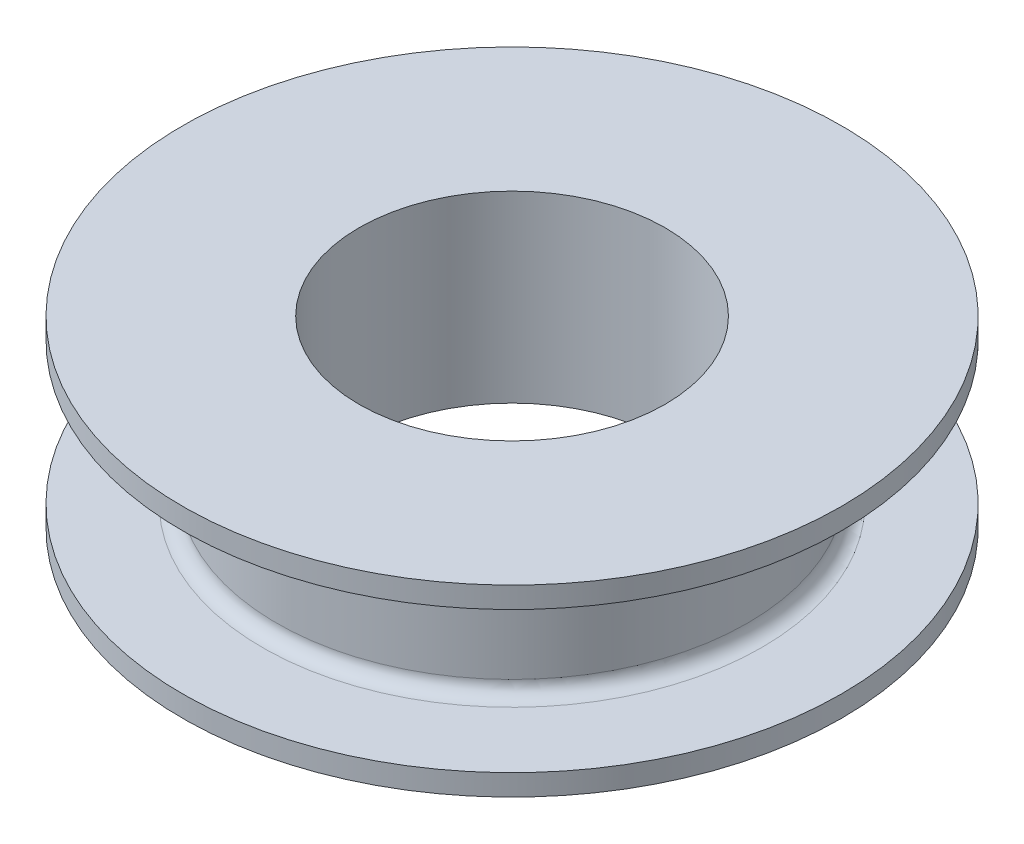
from build123d import *


with BuildPart() as part:
    # ｽｹｯﾁ1 → 回転1 (revolve)
    with BuildSketch(Plane.XY):
        with BuildLine():
            Line((7, 3.45), (5.3, 3.45))
            ThreePointArc((5.3, 3.45), (5.087867966, 3.362132034), (5, 3.15))
            Line((5, 3.15), (5, 0.75))
            ThreePointArc((5, 0.75), (5.087867966, 0.537867966), (5.3, 0.45))
            Line((5.3, 0.45), (7, 0.45))
            Line((7, 0.45), (7, 0))
            Line((7, 0), (3.25, 0))
            Line((3.25, 0), (3.25, 3.9))
            Line((3.25, 3.9), (7, 3.9))
            Line((7, 3.9), (7, 3.45))
        make_face()
    revolve(axis=Axis((0, 1.95, 0), (0, 1, 0)))


solid = part.part
